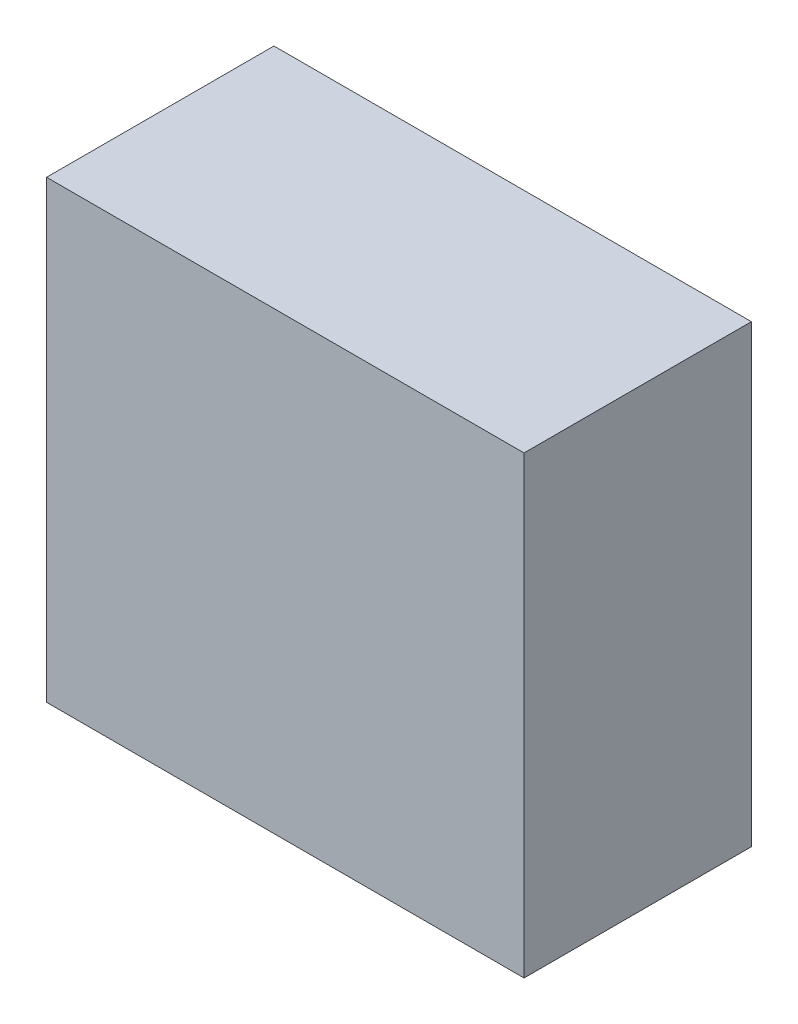
from build123d import *

# Parameters (mm, degrees)
SKETCH1_W           = 42
SKETCH1_H           = 40
BOSS_EXTRUDE1_DEPTH = 20


with BuildPart() as part:
    # Sketch1 → Boss-Extrude1 (new body)
    with BuildSketch(Plane.XY):
        Rectangle(SKETCH1_W, SKETCH1_H)
    extrude(amount=BOSS_EXTRUDE1_DEPTH)


solid = part.part
